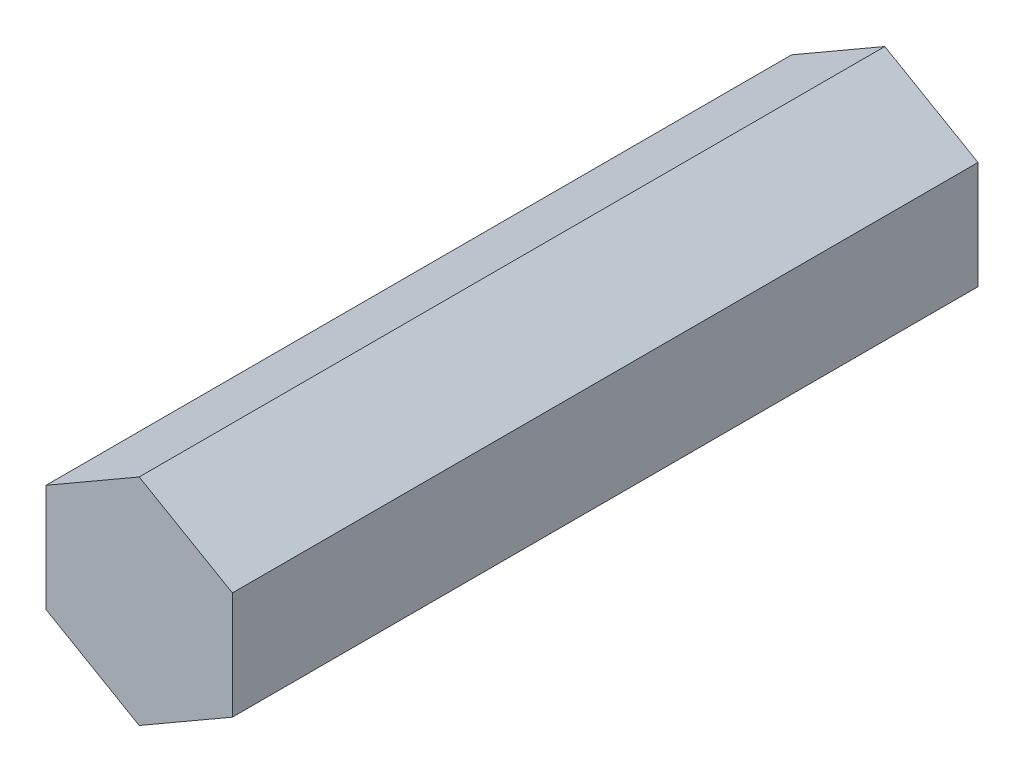
from build123d import *

# Parameters (mm, degrees)
BOSS_EXTRUDE1_DEPTH = 50.8


with BuildPart() as part:
    # Sketch1 → Boss-Extrude1 (new body)
    with BuildSketch(Plane.XY):
        Polygon((-6.35, -3.666174209), (0, -7.332348419), (6.35, -3.666174209), (6.35, 3.666174209), (0, 7.332348419), (-6.35, 3.666174209), align=None)
    extrude(amount=BOSS_EXTRUDE1_DEPTH)


solid = part.part
